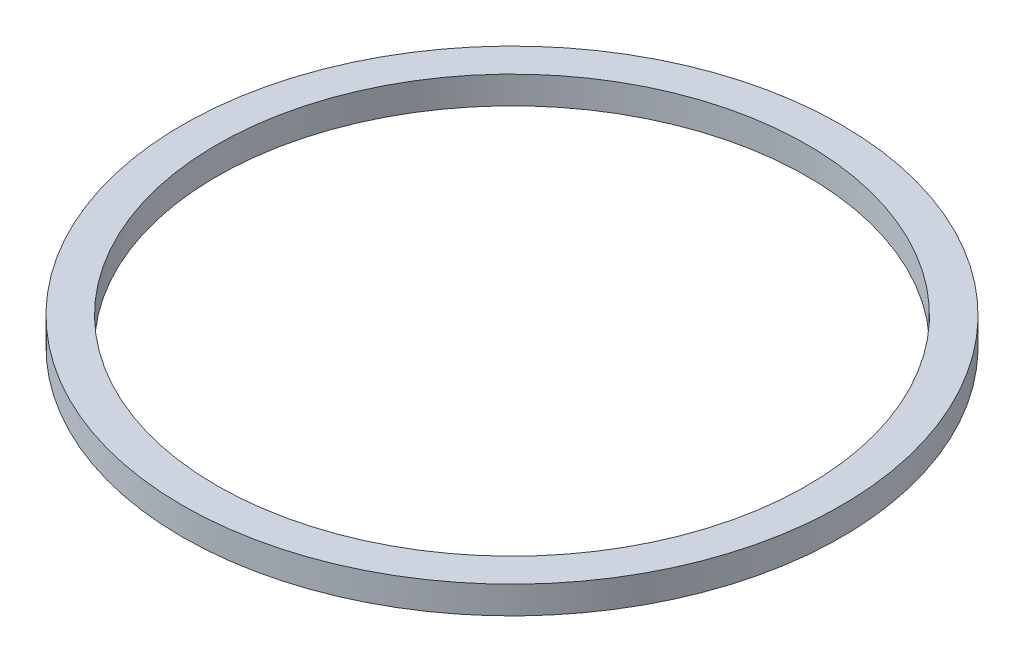
from build123d import *

# Parameters (mm, degrees)
SKETCH1_R           = 12
SKETCH1_R_2         = 10.75
BOSS_EXTRUDE1_DEPTH = 0.5


with BuildPart() as part:
    # Sketch1 → Boss-Extrude1 (new, symmetric)
    with BuildSketch(Plane(origin=(0, 0, 0), x_dir=(1, 0, 0), z_dir=(0, 1, 0))):
        with Locations(Location((0, 0, 0), (0, 0, 270))):
            Circle(SKETCH1_R)
        with Locations(Location((0, 0, 0), (0, 0, 270))):
            Circle(SKETCH1_R_2, mode=Mode.SUBTRACT)
    extrude(amount=BOSS_EXTRUDE1_DEPTH, both=True)


solid = part.part
